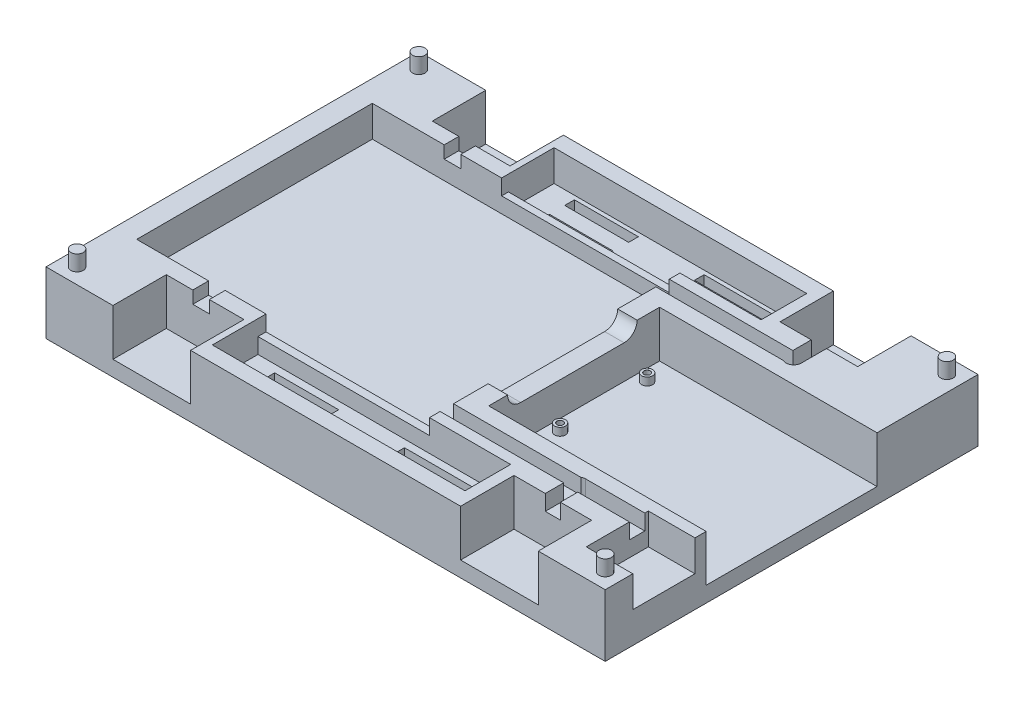
from build123d import *

# Parameters (mm, degrees)
SKETCH1_W                          = 180
SKETCH1_H                          = 120
BOSS_EXTRUDE1_DEPTH                = 20
CUT_EXTRUDE1_DEPTH                 = 15
SKETCH3_W                          = 25
SKETCH3_H                          = 34.37
CUT_EXTRUDE2_DEPTH                 = 15
MIRROR2_COPY_1_SKETCH_W            = 25
MIRROR2_COPY_1_SKETCH_H            = 34.37
MIRROR2_COPY_1_DEPTH               = 15
SKETCH4_W                          = 96.808518295
SKETCH4_H                          = 75.84152956
CUT_EXTRUDE4_DEPTH                 = 10
SKETCH6_R                          = 1.750328968
SKETCH6_R_2                        = 1.75
BOSS_EXTRUDE2_DEPTH                = 2.5
F_2_0_2_DIAMETER_HOLE1_D           = 2
F_2_0_2_DIAMETER_HOLE1_DEPTH       = 2
F_2_0_2_DIAMETER_HOLE1_CSINK_D     = 2.05
F_2_0_2_DIAMETER_HOLE1_CSINK_ANGLE = 92
F_2_0_2_DIAMETER_HOLE1_TIP         = 0.600860619
CUT_EXTRUDE5_DEPTH                 = 10
SKETCH23_R                         = 2
BOSS_EXTRUDE3_DEPTH                = 5
SKETCH25_W                         = 5.325181223
SKETCH25_H                         = 5.082469794
SKETCH25_H_2                       = 4.706000646
CUT_EXTRUDE10_DEPTH                = 4
CUT_EXTRUDE11_DEPTH                = 5
SKETCH28_W                         = 81.316631719
SKETCH28_H                         = 14.691658707
CUT_EXTRUDE12_DEPTH                = 10
SKETCH29_W                         = 55.195697226
SKETCH29_H                         = 2.199341939
CUT_EXTRUDE13_DEPTH                = 5
SKETCH30_W                         = 23.172037828
SKETCH30_H                         = 3.131356463
SKETCH30_H_2                       = 2.952421808
SKETCH30_W_2                       = 20.586646559
CUT_EXTRUDE15_DEPTH                = 110.201648339
SKETCH31_W                         = 55.195697226
SKETCH31_H                         = 0.376469148
CUT_EXTRUDE16_DEPTH                = 5
SKETCH32_W                         = 20
SKETCH32_H                         = 10
CUT_EXTRUDE17_DEPTH                = 15
CUT_EXTRUDE18_DEPTH                = 5


with BuildPart() as part:
    # Sketch1 → Boss-Extrude1 (new body)
    with BuildSketch(Plane(origin=(0, 0, 0), x_dir=(1, 0, 0), z_dir=(0, 1, 0))):
        Rectangle(SKETCH1_W, SKETCH1_H)
    extrude(amount=BOSS_EXTRUDE1_DEPTH)

    # Sketch2 → Cut-Extrude1 (cut)
    with BuildSketch(Plane(origin=(0, 20, 0), x_dir=(1, 0, 0), z_dir=(0, 1, 0))):
        Polygon((90, 0), (90, 27.5), (20, 27.5), (20, -27.5), (90, -27.5), align=None)
    extrude(amount=-CUT_EXTRUDE1_DEPTH, mode=Mode.SUBTRACT)

    # Sketch3 → Cut-Extrude2 (cut)
    with BuildSketch(Plane(origin=(0, 20, 0), x_dir=(1, 0, 0), z_dir=(0, 1, 0))):
        with Locations((55.95586419, -60)):
            Rectangle(SKETCH3_W, SKETCH3_H)
    cut_extrude2 = extrude(amount=-CUT_EXTRUDE2_DEPTH, mode=Mode.SUBTRACT)

    # Mirror1: Cut-Extrude2 across plane
    add(cut_extrude2.mirror(Plane(origin=(0, 0, 0), x_dir=(0, 0, 1), z_dir=(1, 0, 0))), mode=Mode.SUBTRACT)

    # Mirror2: Cut-Extrude2 across plane
    add(cut_extrude2.mirror(Plane.XY), mode=Mode.SUBTRACT)

    # Mirror2 copy 1 sketch → Mirror2 copy 1 (cut)
    with BuildSketch(Plane(origin=(0, 20, 0), x_dir=(-1, 0, 0), z_dir=(0, 1, 0))):
        with Locations((55.95586419, -60)):
            Rectangle(MIRROR2_COPY_1_SKETCH_W, MIRROR2_COPY_1_SKETCH_H)
    extrude(amount=-MIRROR2_COPY_1_DEPTH, mode=Mode.SUBTRACT)

    # Sketch4 → Cut-Extrude4 (cut)
    with BuildSketch(Plane(origin=(0, 20, 0), x_dir=(1, 0, 0), z_dir=(0, 1, 0))):
        with Locations((-34.664426112, 0.188234574)):
            Rectangle(SKETCH4_W, SKETCH4_H)
    extrude(amount=-CUT_EXTRUDE4_DEPTH, mode=Mode.SUBTRACT)

    # Sketch6 → Boss-Extrude2 (add)
    with BuildSketch(Plane(origin=(0, 5, 0), x_dir=(1, 0, 0), z_dir=(0, 1, 0))):
        with Locations(Location((23.740233284, 19.759861377, 0), (0, 0, 270))):
            Circle(SKETCH6_R)
        with Locations(Location((23.740233284, -8.257995296, 0), (0, 0, 270))):
            Circle(SKETCH6_R_2)
        with Locations(Location((74.958841447, -23.692393533, 0), (0, 0, 270))):
            Circle(SKETCH6_R_2)
    extrude(amount=BOSS_EXTRUDE2_DEPTH)

    # Ø2.0 (2) Diameter Hole1
    with Locations(Plane(origin=(23.740233284, 7.5, -19.759861377), x_dir=(0, 0, 1), z_dir=(0, 1, 0))):
        with Locations((0, 0), (28.017856673, 0), (43.45225491, 51.218608163)):
            CounterSinkHole(F_2_0_2_DIAMETER_HOLE1_D / 2, F_2_0_2_DIAMETER_HOLE1_CSINK_D / 2, depth=F_2_0_2_DIAMETER_HOLE1_DEPTH, counter_sink_angle=F_2_0_2_DIAMETER_HOLE1_CSINK_ANGLE)
            with Locations((0, 0, -(F_2_0_2_DIAMETER_HOLE1_DEPTH + F_2_0_2_DIAMETER_HOLE1_TIP / 2))):  # 118° drill point
                Cone(0, F_2_0_2_DIAMETER_HOLE1_D / 2, F_2_0_2_DIAMETER_HOLE1_TIP, mode=Mode.SUBTRACT)

    # Sketch19 → Cut-Extrude5 (cut)
    with BuildSketch(Plane(origin=(20, 0, 0), x_dir=(0, 0, -1), z_dir=(1, 0, 0))):
        with BuildLine():
            Line((-17.205162996, 24.206637085), (16.076682843, 24.206637085))
            ThreePointArc((16.076682843, 24.206637085), (20.283319928, 20), (16.076682843, 15.793362915))
            Line((16.076682843, 15.793362915), (-17.205162996, 15.793362915))
            ThreePointArc((-17.205162996, 15.793362915), (-21.411800081, 20), (-17.205162996, 24.206637085))
        make_face()
    extrude(amount=-CUT_EXTRUDE5_DEPTH, mode=Mode.SUBTRACT)

    # Sketch23 → Boss-Extrude3 (add)
    with BuildSketch(Plane(origin=(0, 20, 0), x_dir=(1, 0, 0), z_dir=(0, 1, 0))):
        with Locations(Location((-85, 55, 0), (0, 0, 90))):
            Circle(SKETCH23_R)
        with Locations(Location((-85, -55, 0), (0, 0, 90))):
            Circle(SKETCH23_R)
    boss_extrude3 = extrude(amount=BOSS_EXTRUDE3_DEPTH)

    # Mirror3: Boss-Extrude3 across plane
    add(boss_extrude3.mirror(Plane(origin=(0, 0, 0), x_dir=(0, 0, 1), z_dir=(1, 0, 0))))

    # Sketch25 → Cut-Extrude10 (cut)
    with BuildSketch(Plane(origin=(0, 20, 0), x_dir=(1, 0, 0), z_dir=(0, 1, 0))):
        with Locations((-57.266281273, -40.273765103)):
            Rectangle(SKETCH25_W, SKETCH25_H)
        with Locations((-57.266281273, 40.461999677)):
            Rectangle(SKETCH25_W, SKETCH25_H_2)
    extrude(amount=-CUT_EXTRUDE10_DEPTH, mode=Mode.SUBTRACT)

    # Sketch27 → Cut-Extrude11 (cut)
    with BuildSketch(Plane(origin=(0, 20, 0), x_dir=(1, 0, 0), z_dir=(0, 1, 0))):
        with BuildLine():
            Line((53.518871282, -42.815), (53.518871282, -34.725256946))
            ThreePointArc((53.518871282, -34.725256946), (55.95586419, -32.288264038), (58.392857098, -34.725256946))
            Line((58.392857098, -34.725256946), (58.392857098, -42.815))
            ThreePointArc((58.392857098, -42.815), (55.95586419, -45.251992908), (53.518871282, -42.815))
        make_face()
        with BuildLine():
            Line((55.95586419, -36.875864951), (13.739833036, -36.875864951))
            ThreePointArc((13.739833036, -36.875864951), (11.589225031, -34.725256946), (13.739833036, -32.574648942))
            Line((13.739833036, -32.574648942), (55.95586419, -32.574648942))
            ThreePointArc((55.95586419, -32.574648942), (58.106472195, -34.725256946), (55.95586419, -36.875864951))
        make_face()
    cut_extrude11 = extrude(amount=-CUT_EXTRUDE11_DEPTH, mode=Mode.SUBTRACT)

    # Mirror4: Cut-Extrude11 across plane
    add(cut_extrude11.mirror(Plane.XY), mode=Mode.SUBTRACT)

    # Sketch28 → Cut-Extrude12 (cut)
    with BuildSketch(Plane(origin=(0, 20, 0), x_dir=(1, 0, 0), z_dir=(0, 1, 0))):
        with Locations((-0.79754833, 47.654170647)):
            Rectangle(SKETCH28_W, SKETCH28_H)
    cut_extrude12 = extrude(amount=-CUT_EXTRUDE12_DEPTH, mode=Mode.SUBTRACT)

    # Sketch29 → Cut-Extrude13 (cut)
    with BuildSketch(Plane(origin=(0, 20, 0), x_dir=(1, 0, 0), z_dir=(0, 1, 0))):
        with Locations((-13.858015577, 39.208670324)):
            Rectangle(SKETCH29_W, SKETCH29_H)
    cut_extrude13 = extrude(amount=-CUT_EXTRUDE13_DEPTH, mode=Mode.SUBTRACT)

    # Sketch30 → Cut-Extrude15 (cut, through all)
    with BuildSketch(Plane(origin=(0, 10, 0), x_dir=(1, 0, 0), z_dir=(0, 1, 0))):
        with Locations((19.694260821, 52.169495653)):
            Rectangle(SKETCH30_W, SKETCH30_H)
        with Locations((19.694260821, 44.206903503)):
            Rectangle(SKETCH30_W, SKETCH30_H_2)
        with Locations((-23.35450663, 52.169495653)):
            Rectangle(SKETCH30_W_2, SKETCH30_H)
        with Locations((-23.35450663, 44.206903503)):
            Rectangle(SKETCH30_W_2, SKETCH30_H_2)
    cut_extrude15 = extrude(amount=-CUT_EXTRUDE15_DEPTH, mode=Mode.SUBTRACT)

    # Mirror5: Cut-Extrude12, Cut-Extrude13, Cut-Extrude15 across plane
    add(cut_extrude12.mirror(Plane.XY), mode=Mode.SUBTRACT)
    add(cut_extrude13.mirror(Plane.XY), mode=Mode.SUBTRACT)
    add(cut_extrude15.mirror(Plane.XY), mode=Mode.SUBTRACT)

    # Sketch31 → Cut-Extrude16 (cut)
    with BuildSketch(Plane(origin=(0, 20, 0), x_dir=(1, 0, 0), z_dir=(0, 1, 0))):
        with Locations((-13.858015577, -37.92076478)):
            Rectangle(SKETCH31_W, SKETCH31_H)
    extrude(amount=-CUT_EXTRUDE16_DEPTH, mode=Mode.SUBTRACT)

    # Sketch32 → Cut-Extrude17 (cut)
    with BuildSketch(Plane(origin=(90, 0, 0), x_dir=(0, 0, -1), z_dir=(1, 0, 0))):
        with Locations((-41.109013554, 15)):
            Rectangle(SKETCH32_W, SKETCH32_H)
    extrude(amount=-CUT_EXTRUDE17_DEPTH, mode=Mode.SUBTRACT)

    # Sketch33 → Cut-Extrude18 (cut)
    with BuildSketch(Plane(origin=(0, 20, 0), x_dir=(1, 0, 0), z_dir=(0, 1, 0))):
        with BuildLine():
            Line((55.95586419, -32.253444684), (75, -32.253444684))
            ThreePointArc((75, -32.253444684), (77.471812262, -34.725256946), (75, -37.197069209))
            Line((75, -37.197069209), (55.95586419, -37.197069209))
            ThreePointArc((55.95586419, -37.197069209), (53.484051928, -34.725256946), (55.95586419, -32.253444684))
        make_face()
    extrude(amount=-CUT_EXTRUDE18_DEPTH, mode=Mode.SUBTRACT)


solid = part.part
